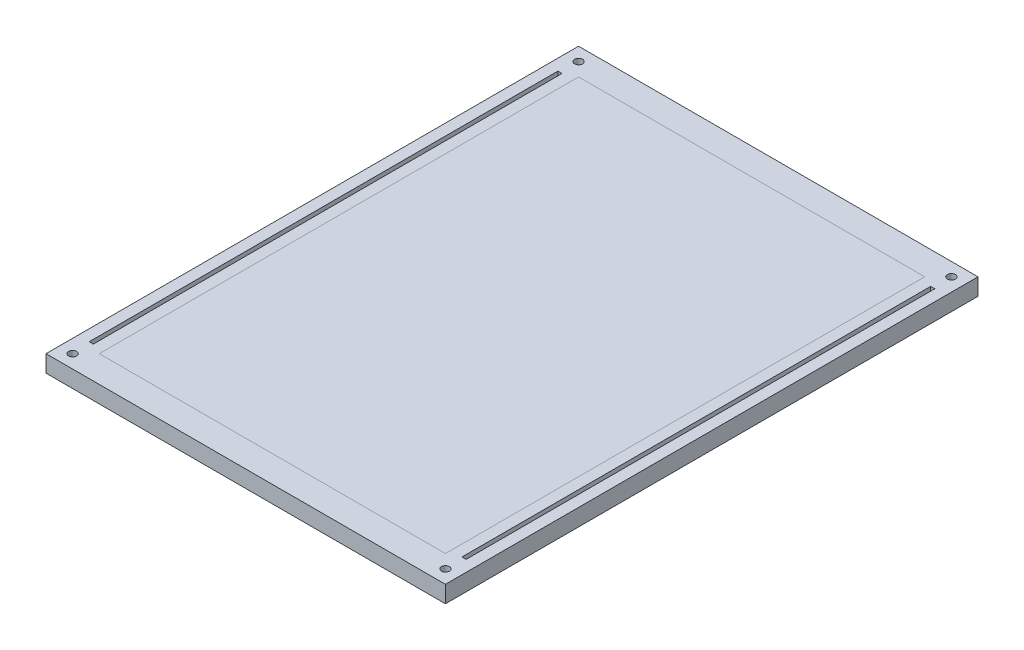
from build123d import *

# Parameters (mm, degrees)
SKETCH1_W           = 150
SKETCH1_H           = 200
SKETCH1_W_2         = 130
SKETCH1_H_2         = 180
MAINBODY_DEPTH      = 3.175
SHEETLOCK_REACH     = 127.161
SKETCH2_W           = 1.55575
SKETCH2_H           = 176
SUPPORTHOLES_REACH  = 127.161
SKETCH3_R           = 1.5
SKETCH4_W           = 180
SKETCH4_H           = 6.35
BOSS_EXTRUDE1_DEPTH = 130


with BuildPart() as part:
    # Sketch1 → MainBody (new, symmetric)
    with BuildSketch(Plane(origin=(0, 0, 0), x_dir=(1, 0, 0), z_dir=(0, 1, 0))):
        Rectangle(SKETCH1_W, SKETCH1_H)
        Rectangle(SKETCH1_W_2, SKETCH1_H_2, mode=Mode.SUBTRACT)
    extrude(amount=MAINBODY_DEPTH, both=True)

    # Sketch2 → SheetLock (cut, up to next)
    with BuildSketch(Plane(origin=(0, 3.175, 0), x_dir=(1, 0, 0), z_dir=(0, 1, 0)), mode=Mode.PRIVATE) as sheetlock_sk1:
        with Locations((-70, 0)):
            Rectangle(SKETCH2_W, SKETCH2_H)
    sheetlock_tool1 = extrude(sheetlock_sk1.sketch, amount=-SHEETLOCK_REACH, mode=Mode.PRIVATE) & part.part
    sheetlock = sheetlock_tool1.solids().sort_by_distance((-70, 3.175, 0))[0]
    add(sheetlock, mode=Mode.SUBTRACT)

    # Mirror1: SheetLock across plane
    add(sheetlock.mirror(Plane(origin=(0, 0, 0), x_dir=(0, 0, 1), z_dir=(1, 0, 0))), mode=Mode.SUBTRACT)

    # Sketch3 → SupportHoles (cut, up to next)
    with BuildSketch(Plane(origin=(0, 3.175, 0), x_dir=(1, 0, 0), z_dir=(0, 1, 0)), mode=Mode.PRIVATE) as supportholes_sk1:
        with Locations(Location((-70, 95, 0), (0, 0, 270))):
            Circle(SKETCH3_R)
    supportholes_tool1 = extrude(supportholes_sk1.sketch, amount=-SUPPORTHOLES_REACH, mode=Mode.PRIVATE) & part.part
    # Sketch3 → SupportHoles (cut, up to next)
    with BuildSketch(Plane(origin=(0, 3.175, 0), x_dir=(1, 0, 0), z_dir=(0, 1, 0)), mode=Mode.PRIVATE) as supportholes_sk2:
        with Locations(Location((70, 95, 0), (0, 0, 90))):
            Circle(SKETCH3_R)
    supportholes_tool2 = extrude(supportholes_sk2.sketch, amount=-SUPPORTHOLES_REACH, mode=Mode.PRIVATE) & part.part
    # Sketch3 → SupportHoles (cut, up to next)
    with BuildSketch(Plane(origin=(0, 3.175, 0), x_dir=(1, 0, 0), z_dir=(0, 1, 0)), mode=Mode.PRIVATE) as supportholes_sk3:
        with Locations(Location((70, -95, 0), (0, 0, 270))):
            Circle(SKETCH3_R)
    supportholes_tool3 = extrude(supportholes_sk3.sketch, amount=-SUPPORTHOLES_REACH, mode=Mode.PRIVATE) & part.part
    # Sketch3 → SupportHoles (cut, up to next)
    with BuildSketch(Plane(origin=(0, 3.175, 0), x_dir=(1, 0, 0), z_dir=(0, 1, 0)), mode=Mode.PRIVATE) as supportholes_sk4:
        with Locations(Location((-70, -95, 0), (0, 0, 90))):
            Circle(SKETCH3_R)
    supportholes_tool4 = extrude(supportholes_sk4.sketch, amount=-SUPPORTHOLES_REACH, mode=Mode.PRIVATE) & part.part
    add(supportholes_tool1.solids().sort_by_distance((-70, 3.175, -95))[0], mode=Mode.SUBTRACT)
    add(supportholes_tool2.solids().sort_by_distance((70, 3.175, -95))[0], mode=Mode.SUBTRACT)
    add(supportholes_tool3.solids().sort_by_distance((70, 3.175, 95))[0], mode=Mode.SUBTRACT)
    add(supportholes_tool4.solids().sort_by_distance((-70, 3.175, 95))[0], mode=Mode.SUBTRACT)


with BuildPart() as body_2:
    # Sketch4 → Boss-Extrude1 (new body)
    with BuildSketch(Plane.ZY.offset(-65)):
        Rectangle(SKETCH4_W, SKETCH4_H)
    extrude(amount=BOSS_EXTRUDE1_DEPTH)


solid = Compound([part.part, body_2.part])
